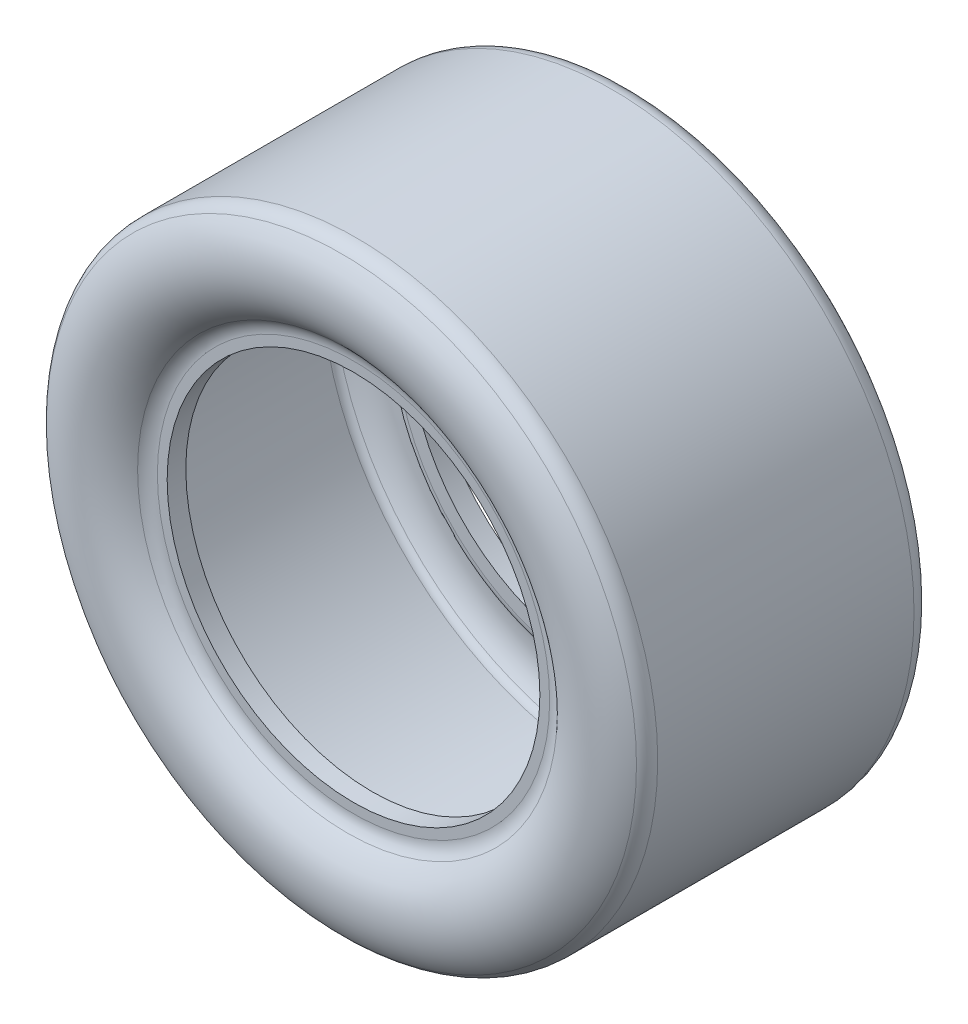
from build123d import *

# Parameters (mm, degrees)
FILLET1_R = 12.7


with BuildPart() as part:
    # Sketch1 → Revolve1 (revolve)
    with BuildSketch(Plane(origin=(0, 0, 0), x_dir=(0, 0, -1), z_dir=(1, 0, 0))):
        with BuildLine():
            Line((-92.71, 205.74), (92.71, 205.74))
            ThreePointArc((92.71, 205.74), (106.68, 171.804134615), (88.9, 139.7))
            Line((88.9, 139.7), (88.9, 127))
            Line((88.9, 127), (76.2, 127))
            Line((76.2, 127), (76.2, 136.77458415))
            ThreePointArc((76.2, 136.77458415), (77.341702115, 140.875929948), (80.438371617, 143.797429404))
            ThreePointArc((80.438371617, 143.797429404), (98.03590274, 166.972484114), (91.58192014, 195.346810028))
            ThreePointArc((91.58192014, 195.346810028), (89.358537587, 197.155629346), (86.566259724, 197.8025))
            Line((86.566259724, 197.8025), (-86.566259724, 197.8025))
            ThreePointArc((-86.566259724, 197.8025), (-89.358537587, 197.155629346), (-91.58192014, 195.346810028))
            ThreePointArc((-91.58192014, 195.346810028), (-98.03590274, 166.972484114), (-80.438371617, 143.797429404))
            ThreePointArc((-80.438371617, 143.797429404), (-77.341702115, 140.875929948), (-76.2, 136.77458415))
            Line((-76.2, 136.77458415), (-76.2, 127))
            Line((-76.2, 127), (-88.9, 127))
            Line((-88.9, 127), (-88.9, 139.7))
            ThreePointArc((-88.9, 139.7), (-106.68, 171.804134615), (-92.71, 205.74))
        make_face()
    revolve(axis=Axis((0, 0, 0), (0, 0, 1)))

    # Fillet1
    fillet1_edges = [part.edges().sort_by_distance(p)[0] for p in [
        (0, -139.7, -88.9),
        (0, -139.7, 88.9),
        (0, -205.74, -92.71),
        (0, -205.74, 92.71),
    ]]
    fillet(fillet1_edges, radius=FILLET1_R)


solid = part.part
